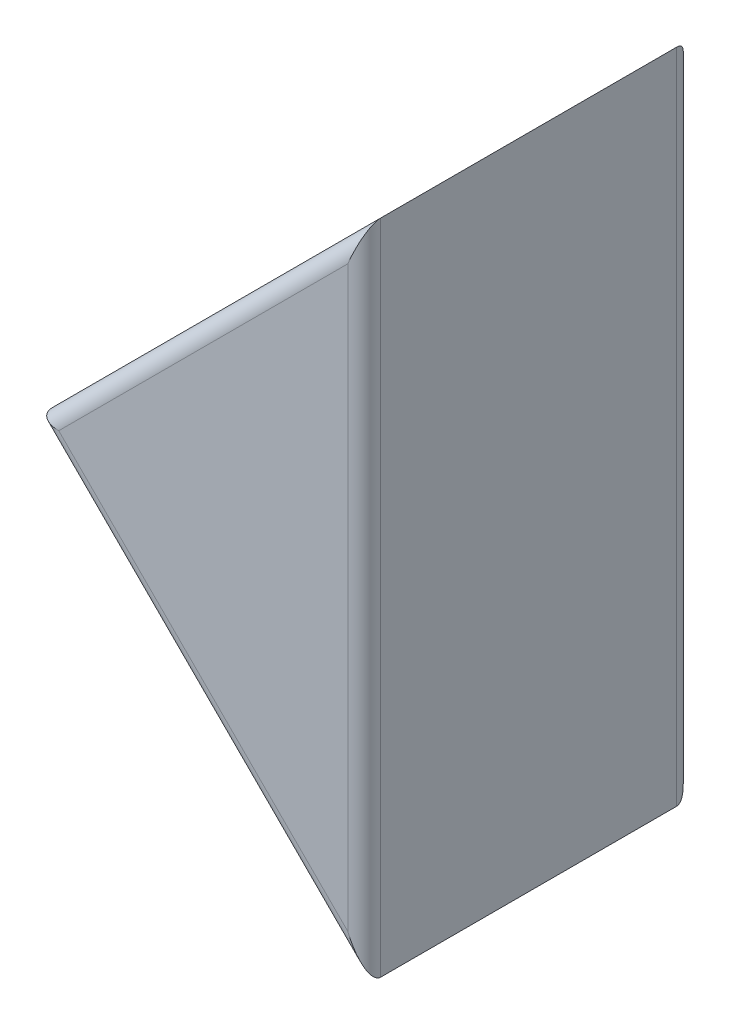
from build123d import *

# Parameters (mm, degrees)
SKETCH1_W           = 20
SKETCH1_H           = 20
BOSS_EXTRUDE1_DEPTH = 40
CUT_EXTRUDE1_DEPTH  = 46.82575695
FILLET1_R           = 1


with BuildPart() as part:
    # Sketch1 → Boss-Extrude1 (new body)
    with BuildSketch(Plane(origin=(0, 0, 0), x_dir=(1, 0, 0), z_dir=(0, 1, 0))):
        Rectangle(SKETCH1_W, SKETCH1_H)
    extrude(amount=BOSS_EXTRUDE1_DEPTH)

    # Sketch2 → Cut-Extrude1 (cut, through all)
    with BuildSketch(Plane.XY.offset(10)):
        Polygon((-10, 20), (10, 40), (-10, 40), align=None)
        Polygon((10, 0), (-10, 20), (-10, 0), align=None)
    extrude(amount=-CUT_EXTRUDE1_DEPTH, mode=Mode.SUBTRACT)

    # Fillet1
    fillet1_edges = [part.edges().sort_by_distance(p)[0] for p in [
        (0, 30, 10),
        (0, 30, -10),
        (0, 10, 10),
        (0, 10, -10),
        (10, 20, 10),
        (10, 20, -10),
    ]]
    fillet(fillet1_edges, radius=FILLET1_R)


solid = part.part
